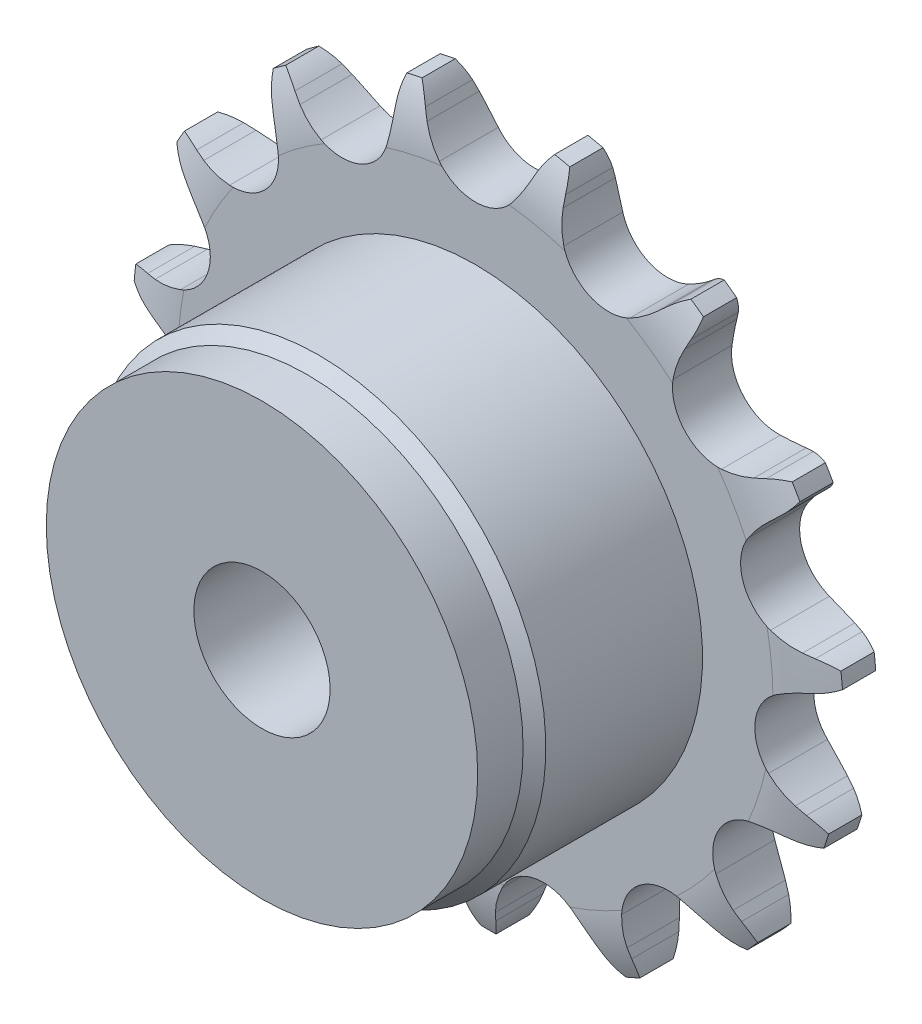
from build123d import *

# Parameters (mm, degrees)
CUT_EXTRUDE1_DEPTH      = 23.54315441
CIRPATTERN1_COUNT       = 15
BOSS_EXTRUDE1_START     = 1.3
SKETCH2_R               = 10
BOSS_EXTRUDE1_DEPTH     = 7.4
CUT_EXTRUDE2_DEPTH      = 25.083300715
CUT_EXTRUDE2_DEPTH_BACK = 25.083300715
SKETCH3_R               = 3
SKETCH4_W               = 1.95
SKETCH4_H               = 5.584687294
CUT_EXTRUDE3_DEPTH      = 25.083300715
CUT_EXTRUDE3_DEPTH_BACK = 25.083300715
SKETCH5_OUTSIDE_W       = 42.85
SKETCH5_OUTSIDE_H       = 42.678
SKETCH5_OUTSIDE_R       = 15.65
BOSS_EXTRUDE2_START     = 2
SKETCH6_R               = 9.5
SKETCH6_R_2             = 3
BOSS_EXTRUDE2_DEPTH     = 2


with BuildPart() as part:
    # Sketch1 → Revolve1 (revolve)
    with BuildSketch(Plane(origin=(0, 0, 0), x_dir=(0, 0, -1), z_dir=(1, 0, 0))):
        with BuildLine():
            Line((1.3, 0), (-1.3, 0))
            Line((-1.3, 0), (-1.3, 13.101418106))
            ThreePointArc((-1.3, 13.101418106), (-1.122370651, 14.550555781), (-0.6, 15.913890328))
            Line((-0.6, 15.913890328), (0.6, 15.913890328))
            ThreePointArc((0.6, 15.913890328), (1.122370651, 14.550555781), (1.3, 13.101418106))
            Line((1.3, 13.101418106), (1.3, 0))
        make_face()
    revolve(axis=Axis((0, 0, -1.3), (0, 0, 1)))

    # Sketch0 → Cut-Extrude1 (cut, symmetric)
    with BuildSketch(Plane.XY):
        with BuildLine():
            Line((5.458731892, -13.819129077), (5.192148114, -13.461913404))
            ThreePointArc((5.192148114, -13.461913404), (4.769815507, -12.963915887), (4.288911093, -12.522217685))
            ThreePointArc((4.288911093, -12.522217685), (2.574176066, -12.110546227), (1.175129538, -13.184072386))
            ThreePointArc((1.175129538, -13.184072386), (0.915456339, -13.78318522), (0.732190143, -14.409906736))
            Line((0.732190143, -14.409906736), (0.633946447, -14.844668882))
            ThreePointArc((0.633946447, -14.844668882), (-0.774190712, -16.881356201), (-3.200657759, -17.374512534))
            ThreePointArc((-3.200657759, -17.374512534), (3.673146461, -17.280795438), (9.99079726, -14.570582212))
            ThreePointArc((9.99079726, -14.570582212), (7.573524561, -15.106994545), (5.458731892, -13.819129077))
        make_face()
    cut_extrude1 = extrude(amount=CUT_EXTRUDE1_DEPTH, both=True, mode=Mode.SUBTRACT)

    # CirPattern1: Cut-Extrude1 ×15 about axis
    cirpattern1_axis = Axis((0, 0, 0), (0, 0, 1))
    for i in range(1, CIRPATTERN1_COUNT):
        add(cut_extrude1.rotate(cirpattern1_axis, i * 360 / CIRPATTERN1_COUNT), mode=Mode.SUBTRACT)

    # Sketch2 → Boss-Extrude1 (add)
    with BuildSketch(Plane.XY.offset(BOSS_EXTRUDE1_START)):
        with Locations(Location((0, 0, 0), (0, 0, 270))):
            Circle(SKETCH2_R)
    extrude(amount=BOSS_EXTRUDE1_DEPTH)

    # Sketch3 → Cut-Extrude2 (cut, two sides: drawn at the far end of the back side and taken through both)
    with BuildSketch(Plane.XY.offset(-CUT_EXTRUDE2_DEPTH_BACK)):
        Circle(SKETCH3_R)
    extrude(amount=CUT_EXTRUDE2_DEPTH + CUT_EXTRUDE2_DEPTH_BACK, mode=Mode.SUBTRACT)

    # Sketch4 → Cut-Revolve1 (revolve, cut)
    with BuildSketch(Plane(origin=(0, 0, 0), x_dir=(0, 0, -1), z_dir=(1, 0, 0))):
        Polygon((-8.7, 10), (-8.7, 9.5), (-8.2, 10), align=None)
        with Locations((-2.275, 13.121546681)):
            Rectangle(SKETCH4_W, SKETCH4_H)
    revolve(axis=Axis((0, 0, -1.3), (0, 0, 1)), mode=Mode.SUBTRACT)

    # Sketch5 outside → Cut-Extrude3 (cut, two sides: drawn at the far end of the back side and taken through both)
    with BuildSketch(Plane.XY.offset(-CUT_EXTRUDE3_DEPTH_BACK)):
        with Locations((0, -0.155)):
            Rectangle(SKETCH5_OUTSIDE_W, SKETCH5_OUTSIDE_H)
        Circle(SKETCH5_OUTSIDE_R, mode=Mode.SUBTRACT)
    extrude(amount=CUT_EXTRUDE3_DEPTH + CUT_EXTRUDE3_DEPTH_BACK, mode=Mode.SUBTRACT)

    # Sketch6 → Boss-Extrude2 (add)
    with BuildSketch(Plane.XY.offset(8.7).offset(BOSS_EXTRUDE2_START)):
        Circle(SKETCH6_R)
        Circle(SKETCH6_R_2, mode=Mode.SUBTRACT)
    extrude(amount=-BOSS_EXTRUDE2_DEPTH)


solid = part.part
